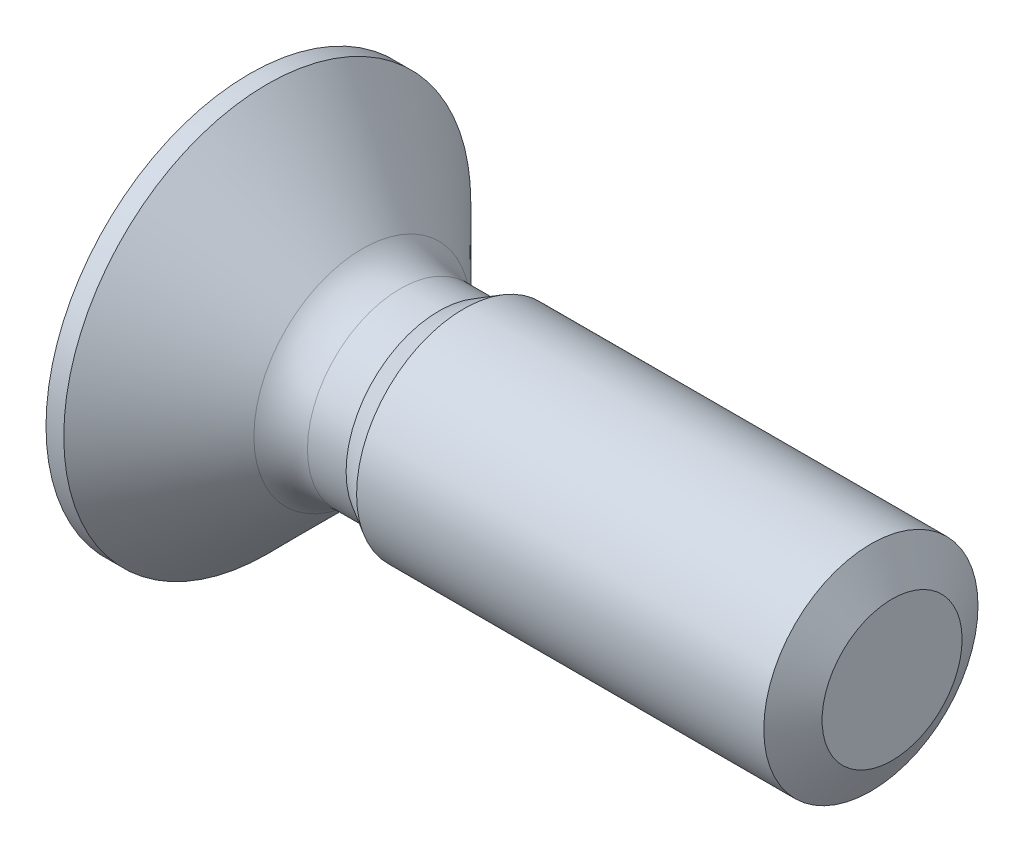
from build123d import *

# Parameters (mm, degrees)
PATTERN_CIRCULAR_1_COUNT = 2
PATTERN_CIRCULAR_1_ANGLE = 90


with BuildPart() as part:
    # 草图1 → Revolve 694 (revolve)
    with BuildSketch(Plane.XY, mode=Mode.PRIVATE) as revolve_694_sk:
        with BuildLine():
            Line((0, 0), (0, 1.9))
            Line((0, 1.9), (0.166, 1.9))
            Line((0.166, 1.9), (1.053553391, 1.012446609))
            ThreePointArc((1.053553391, 1.012446609), (1.215765065, 0.904060234), (1.407106781, 0.866))
            Line((1.407106781, 0.866), (1.767905192, 0.866))
            Line((1.767905192, 0.866), (2, 1))
            Line((2, 1), (6, 1))
            Line((6, 1), (6, 0))
            Line((6, 0), (0, 0))
        make_face()
    revolve(revolve_694_sk.sketch.rotate(Axis((0, 0, 0), (1, 0, 0)), 90), axis=Axis((0, 0, 0), (1, 0, 0)))

    # 草图2 → 切除-旋转1 (revolve, cut)
    with BuildSketch(Plane.XY, mode=Mode.PRIVATE) as cut_revolve_1_sk:
        Polygon((5.802166402, 1), (6.202166402, 1), (6, 0.6536), align=None)
    revolve(cut_revolve_1_sk.sketch.rotate(Axis((0, 0, 0), (-1, 0, 0)), 270), axis=Axis((0, 0, 0), (-1, 0, 0)), mode=Mode.SUBTRACT)

    # 草图3 → 切除-放样1 section 0
    with BuildSketch(Plane.ZY, mode=Mode.PRIVATE) as loft_1_s0:
        with BuildLine():
            Line((-0.95, 0.2), (0.95, 0.2))
            Line((0.95, 0.2), (0.95, -0.2))
            Line((0.95, -0.2), (-0.95, -0.2))
            Line((-0.95, -0.2), (-0.95, 0.2))
        make_face()
    loft_1 = loft([loft_1_s0.sketch, Vertex(1.2, 0, 0)], mode=Mode.SUBTRACT)

    # 阵列(圆周)1: 切除-放样1 ×2 about axis
    pattern_circular_1_axis = Axis((0, 0, 0), (1, 0, 0))
    for i in range(1, PATTERN_CIRCULAR_1_COUNT):
        add(loft_1.rotate(pattern_circular_1_axis, i * PATTERN_CIRCULAR_1_ANGLE / (PATTERN_CIRCULAR_1_COUNT - 1)), mode=Mode.SUBTRACT)


solid = part.part
